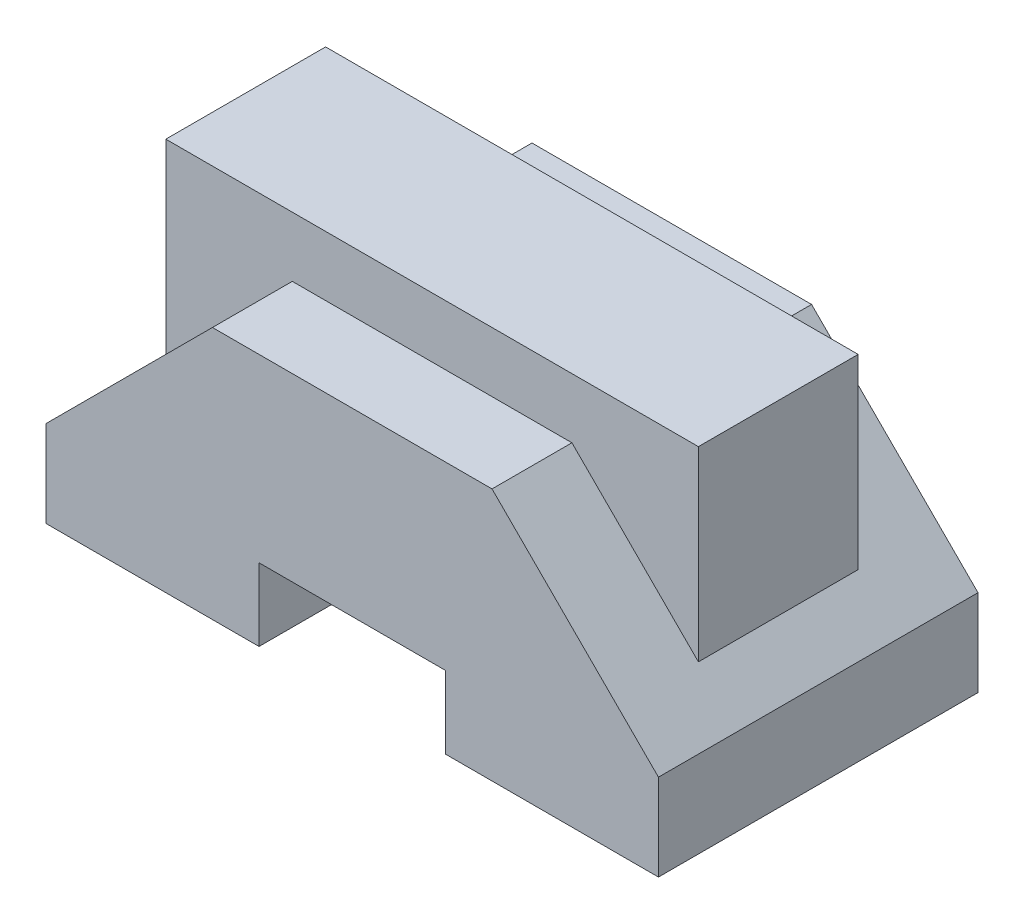
from build123d import *

# Parameters (mm, degrees)
BOSS_EXTRUDE1_DEPTH = 24
BOSS_EXTRUDE2_START = 47
SKETCH2_W           = 80
SKETCH2_H           = 24
BOSS_EXTRUDE2_DEPTH = 36


with BuildPart() as part:
    # Sketch1 → Boss-Extrude1 (new, symmetric)
    with BuildSketch(Plane.XY):
        Polygon((-14, 10.891224152), (0, 10.891224152), (0, 38), (-21, 38), (-46, 13), (-46, 0), (-14, 0), align=None)
        Polygon((14, 10.891224152), (14, 0), (46, 0), (46, 13), (21, 38), (0, 38), (0, 10.891224152), align=None)
    extrude(amount=BOSS_EXTRUDE1_DEPTH, both=True)

    # Sketch2 → Boss-Extrude2 (add)
    with BuildSketch(Plane(origin=(0, 0, 0), x_dir=(1, 0, 0), z_dir=(0, 1, 0)).offset(BOSS_EXTRUDE2_START)):
        Rectangle(SKETCH2_W, SKETCH2_H)
    extrude(amount=-BOSS_EXTRUDE2_DEPTH)


solid = part.part
